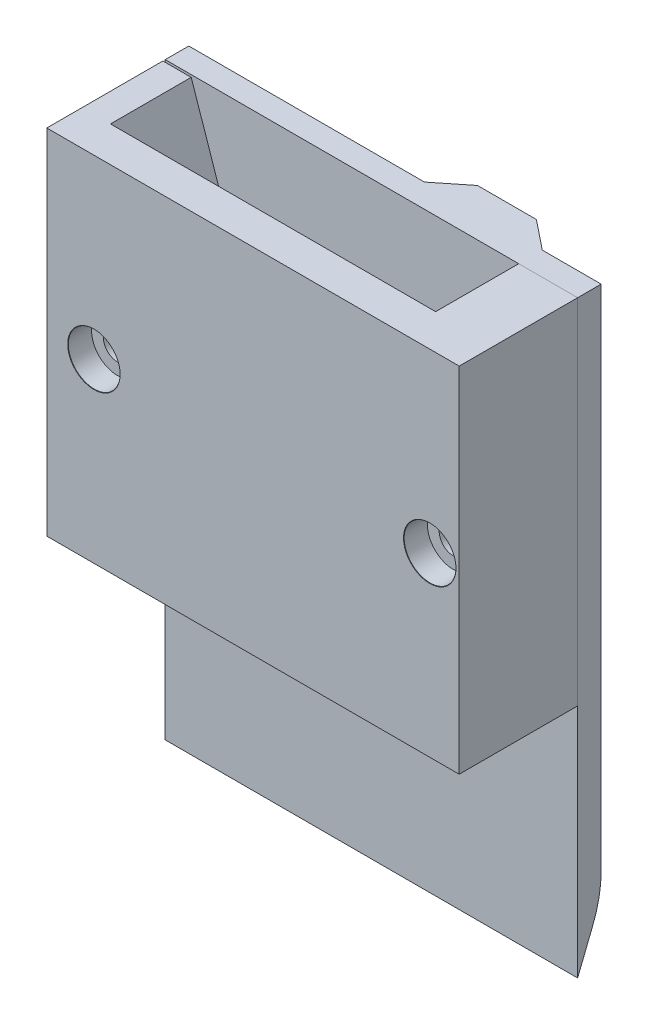
from build123d import *

# Parameters (mm, degrees)
BOSS_EXTRUDE2_START           = -0.2
SKETCH1_W                     = 35
SKETCH1_H                     = 50
BOSS_EXTRUDE2_DEPTH           = 2
BOSS_EXTRUDE3_DEPTH           = 6.85
BOSS_EXTRUDE4_DEPTH           = 50
SKETCH3_W                     = 35
SKETCH3_H                     = 30
BOSS_EXTRUDE5_DEPTH           = 3
SKETCH4_W                     = 5
SKETCH4_H                     = 30
BOSS_EXTRUDE6_DEPTH           = 7.05
CBORE_FOR_M2_SHCS1_AT_2_COUNT = 2
CBORE_FOR_M2_SHCS1_AT_2_PITCH = 28.5
CUT_EXTRUDE1_DEPTH            = 1
CUT_EXTRUDE2_DEPTH            = 1621.991940329
FILLET1_R                     = 10


with BuildPart() as part:
    # Sketch1 → Boss-Extrude2 (new body)
    with BuildSketch(Plane.XY.offset(1400.144561134).offset(BOSS_EXTRUDE2_START)):
        with Locations((750.459950432, 773.940052935)):
            Rectangle(SKETCH1_W, SKETCH1_H)
    extrude(amount=-BOSS_EXTRUDE2_DEPTH)

    # Sketch2 → Boss-Extrude4 (add)
    with BuildSketch(Plane.XZ.offset(-748.940052935)):
        Polygon((752.959950432, 1397.944561134), (755.459950432, 1395.944561134), (760.459950432, 1395.944561134), (762.959950432, 1397.944561134), align=None)
    extrude(amount=-BOSS_EXTRUDE4_DEPTH)


with BuildPart() as body_2:
    # Sketch1<4> → Boss-Extrude3 (new body)
    with BuildSketch(Plane.XY.offset(1400.144561134)):
        with BuildLine():
            Line((732.959950432, 798.940052935), (732.959950432, 768.940052935))
            Line((732.959950432, 768.940052935), (736.521730144, 768.940052935))
            Line((736.521730144, 768.940052935), (738.1725657, 769.940052935))
            Line((738.1725657, 769.940052935), (742.099132051, 772.318585634))
            ThreePointArc((742.099132051, 772.318585634), (743.279516949, 773.755679726), (743.299218285, 775.615292533))
            Line((743.299218285, 775.615292533), (736.724735191, 794.940052935))
            Line((736.724735191, 794.940052935), (735.363893875, 798.940052935))
            Line((735.363893875, 798.940052935), (732.959950432, 798.940052935))
        make_face()
    extrude(amount=BOSS_EXTRUDE3_DEPTH)

    # Sketch3 → Boss-Extrude5 (add)
    with BuildSketch(Plane.XY.offset(1406.994561134)):
        with Locations((750.459950432, 783.940052935)):
            Rectangle(SKETCH3_W, SKETCH3_H)
    extrude(amount=BOSS_EXTRUDE5_DEPTH)

    # Sketch4 → Boss-Extrude6 (add)
    with BuildSketch(Plane(origin=(0, 0, 1406.994561134), x_dir=(-1, 0, 0), z_dir=(0, 0, -1))):
        with Locations((-765.459950432, 783.940052935)):
            Rectangle(SKETCH4_W, SKETCH4_H)
    extrude(amount=BOSS_EXTRUDE6_DEPTH)


with BuildPart() as cbore_for_m2_shcs1_tool:
    # Sketch6 → CBORE for M2 SHCS1 (revolve)
    with BuildSketch(Plane(origin=(736.959950432, 783.940052935, 1409.994561134), x_dir=(0, -1, 0), z_dir=(1, 0, 0))):
        Polygon((0, 0), (0, 14.05), (1.2, 14.05), (1.2, 2), (2.2, 2), (2.2, 0.025), (2.225, 0), align=None)
    cbore_for_m2_shcs1 = revolve(axis=Axis((736.959950432, 783.940052935, 1416.344561134), (0, 0, -1)))


with BuildPart() as part_1:
    add(part.part)

    # CBORE for M2 SHCS1: cut by cbore_for_m2_shcs1_tool
    add(cbore_for_m2_shcs1_tool.part, mode=Mode.SUBTRACT)


with BuildPart() as body_2_1:
    add(body_2.part)

    # CBORE for M2 SHCS1: cut by cbore_for_m2_shcs1_tool
    add(cbore_for_m2_shcs1_tool.part, mode=Mode.SUBTRACT)


with BuildPart() as cbore_for_m2_shcs1_at_2_tool:
    # CBORE for M2 SHCS1 at 2: CBORE for M2 SHCS1 ×2
    with Locations(*[(i * CBORE_FOR_M2_SHCS1_AT_2_PITCH, 0, 0) for i in range(1, CBORE_FOR_M2_SHCS1_AT_2_COUNT)]):
        add(cbore_for_m2_shcs1)


with BuildPart() as part_2:
    add(part_1.part)

    # CBORE for M2 SHCS1 at 2: cut by cbore_for_m2_shcs1_at_2_tool
    add(cbore_for_m2_shcs1_at_2_tool.part, mode=Mode.SUBTRACT)

    # Sketch7 → Cut-Extrude1 (cut)
    with BuildSketch(Plane(origin=(0, 0, 1397.944561134), x_dir=(-1, 0, 0), z_dir=(0, 0, -1))):
        Polygon((-763.359950432, 785.152488501), (-765.459950432, 786.364924066), (-767.559950432, 785.152488501), (-767.559950432, 782.72761737), (-765.459950432, 781.515181805), (-763.359950432, 782.72761737), align=None)
        Polygon((-734.859950432, 785.152488501), (-736.959950432, 786.364924066), (-739.059950432, 785.152488501), (-739.059950432, 782.72761737), (-736.959950432, 781.515181805), (-734.859950432, 782.72761737), align=None)
    extrude(amount=-CUT_EXTRUDE1_DEPTH, mode=Mode.SUBTRACT)

    # Sketch8 → Cut-Extrude2 (cut, through all)
    with BuildSketch(Plane(origin=(767.959950432, 0, 0), x_dir=(0, 0, -1), z_dir=(1, 0, 0))):
        Polygon((-1399.944561134, 748.940052935), (-1395.944561134, 758.940052935), (-1395.944561134, 748.940052935), align=None)
    extrude(amount=-CUT_EXTRUDE2_DEPTH, mode=Mode.SUBTRACT)

    # Fillet1
    fillet1_edges = [part_2.edges().sort_by_distance(p)[0] for p in [
        (742.959950432, 753.940052935, 1397.944561134),
        (765.459950432, 753.940052935, 1397.944561134),
        (757.959950432, 758.940052935, 1395.944561134),
    ]]
    fillet(fillet1_edges, radius=FILLET1_R)


with BuildPart() as body_2_2:
    add(body_2_1.part)

    # CBORE for M2 SHCS1 at 2: cut by cbore_for_m2_shcs1_at_2_tool
    add(cbore_for_m2_shcs1_at_2_tool.part, mode=Mode.SUBTRACT)


solid = Compound([part_2.part, body_2_2.part])
